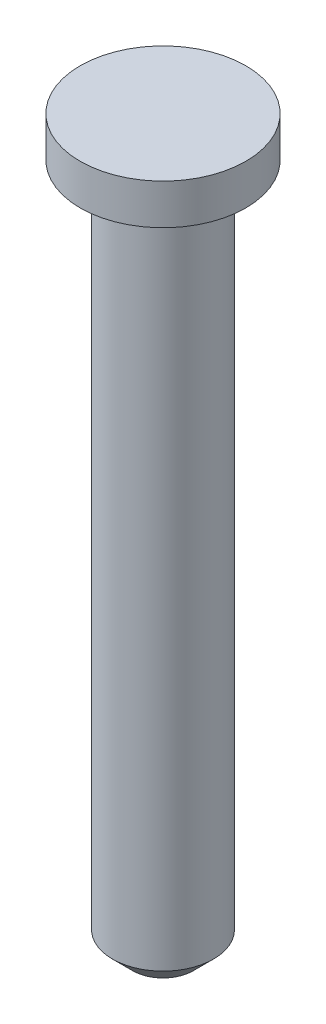
from build123d import *

# Parameters (mm, degrees)
CHAFL_N1_SIZE = 0.5


with BuildPart() as part:
    # Croquis1 → Revolución1 (revolve)
    with BuildSketch(Plane.XY, mode=Mode.PRIVATE) as revoluci_n1_sk:
        Polygon((0, 0), (2.05, 0), (2.05, -1), (1.25, -1), (1.25, -18), (0, -18), align=None)
    revolve(revoluci_n1_sk.sketch.rotate(Axis((0, 0, 0), (0, -1, 0)), 90), axis=Axis((0, 0, 0), (0, -1, 0)))

    # Chaflán1
    chafl_n1_edges = [part.edges().sort_by_distance(p)[0] for p in [
        (0, -18, -1.25),
    ]]
    chamfer(chafl_n1_edges, length=CHAFL_N1_SIZE)


solid = part.part
